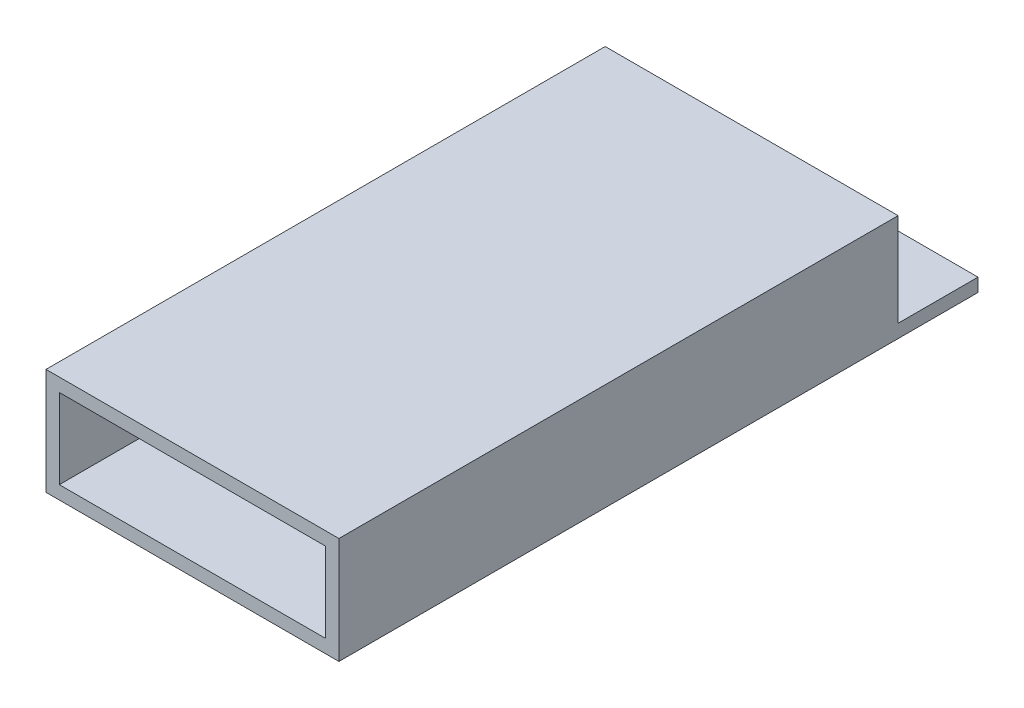
from build123d import *

# Parameters (mm, degrees)
SKETCH1_W           = 220
SKETCH1_H           = 80
SKETCH1_W_2         = 200
SKETCH1_H_2         = 60
BOSS_EXTRUDE1_DEPTH = 420
SKETCH3_W           = 220
SKETCH3_H           = 10
BOSS_EXTRUDE3_DEPTH = 60


with BuildPart() as part:
    # Sketch1 → Boss-Extrude1 (new body)
    with BuildSketch(Plane.XY):
        Rectangle(SKETCH1_W, SKETCH1_H)
        Rectangle(SKETCH1_W_2, SKETCH1_H_2, mode=Mode.SUBTRACT)
    extrude(amount=BOSS_EXTRUDE1_DEPTH)

    # Sketch3 → Boss-Extrude3 (add)
    with BuildSketch(Plane(origin=(0, 0, 0), x_dir=(-1, 0, 0), z_dir=(0, 0, -1))):
        with Locations((0, -35)):
            Rectangle(SKETCH3_W, SKETCH3_H)
    extrude(amount=BOSS_EXTRUDE3_DEPTH)


solid = part.part
